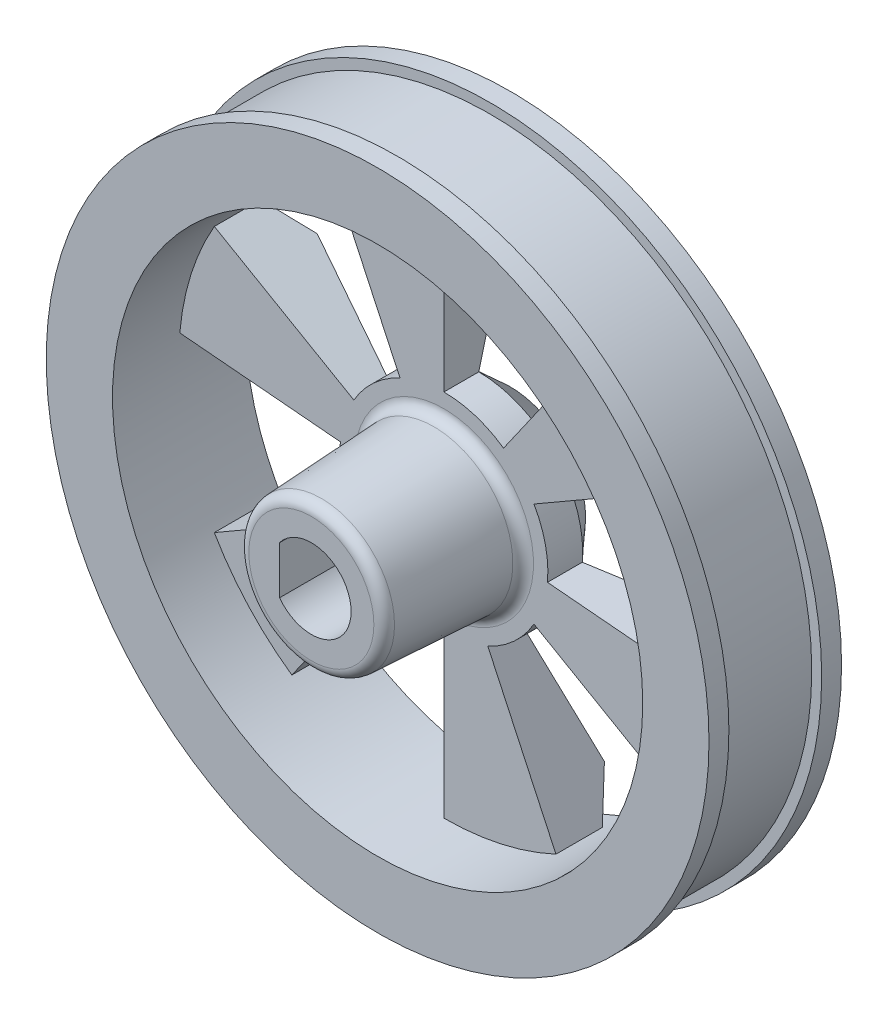
from build123d import *
from build123d.topology import SkipClean

# Parameters (mm, degrees)
CUT_EXTRUDE1_DEPTH  = 37.742346
CIRPATTERN1_COUNT   = 6
SKETCH5_R           = 6
BOSS_EXTRUDE1_DEPTH = 10
BOSS_EXTRUDE1_TAPER = 3
FILLET1_R           = 0.8
CUT_EXTRUDE2_DEPTH  = 10


with BuildPart() as part:
    # Sketch1 → Revolve1 (revolve)
    with BuildSketch(Plane(origin=(0, 0, 0), x_dir=(0, 0, -1), z_dir=(1, 0, 0)), mode=Mode.PRIVATE) as revolve1_sk:
        Polygon((3.5, 25), (5, 25), (5, 20), (3.5, 20), (5, 16.816194), (2.626356, 7.84421), (5, 5.691196), (5, 0), (0, 0), (0, 20), (-5, 20), (-5, 25), (-3.5, 25), (-3.5, 24.25), (3.5, 24.25), align=None)
    revolve(revolve1_sk.sketch.rotate(Axis((0, 0, 0), (0, 0, -1)), 90), axis=Axis((0, 0, 0), (0, 0, -1)))

    # Sketch4 → Cut-Extrude1 (cut, through all)
    with BuildSketch(Plane(origin=(0, 0, -5), x_dir=(-1, 0, 0), z_dir=(0, 0, -1))):
        with BuildLine():
            Line((0, -7.84421), (0, -20))
            ThreePointArc((0, -20), (6.014116, -19.074339), (11.471529, -16.383041))
            Line((11.471529, -16.383041), (4.499254, -6.425601))
            ThreePointArc((4.499254, -6.425601), (2.358799, -7.481156), (0, -7.84421))
        make_face()
    cut_extrude1 = extrude(amount=-CUT_EXTRUDE1_DEPTH, mode=Mode.SUBTRACT)

    # CirPattern1: Cut-Extrude1 ×6 about axis
    with SkipClean():  # the faces are left unmerged after this step: merging them gives an invalid solid
        cirpattern1_axis = Axis((0, 0, 0), (0, 0, 1))
        for i in range(1, CIRPATTERN1_COUNT):
            add(cut_extrude1.rotate(cirpattern1_axis, i * 360 / CIRPATTERN1_COUNT), mode=Mode.SUBTRACT)

    # Sketch5 → Boss-Extrude1 (add)
    with SkipClean():  # the faces are left unmerged after this step: merging them gives an invalid solid
        with BuildSketch(Plane.XY):
            Circle(SKETCH5_R)
        extrude(amount=BOSS_EXTRUDE1_DEPTH, taper=BOSS_EXTRUDE1_TAPER)

    # Fillet1
    fillet1_edges = [part.edges().sort_by_distance(p)[0] for p in [
        (-6, 0, 0),
        (-5.475922, 0, 10),
    ]]
    fillet(fillet1_edges, radius=FILLET1_R)

    # Sketch6 → Cut-Extrude2 (cut)
    with BuildSketch(Plane.XY.offset(10)):
        with BuildLine():
            Line((-2.4, 1.8), (-2.4, -1.8))
            ThreePointArc((-2.4, -1.8), (3, 0), (-2.4, 1.8))
        make_face()
    extrude(amount=-CUT_EXTRUDE2_DEPTH, mode=Mode.SUBTRACT)


solid = part.part
